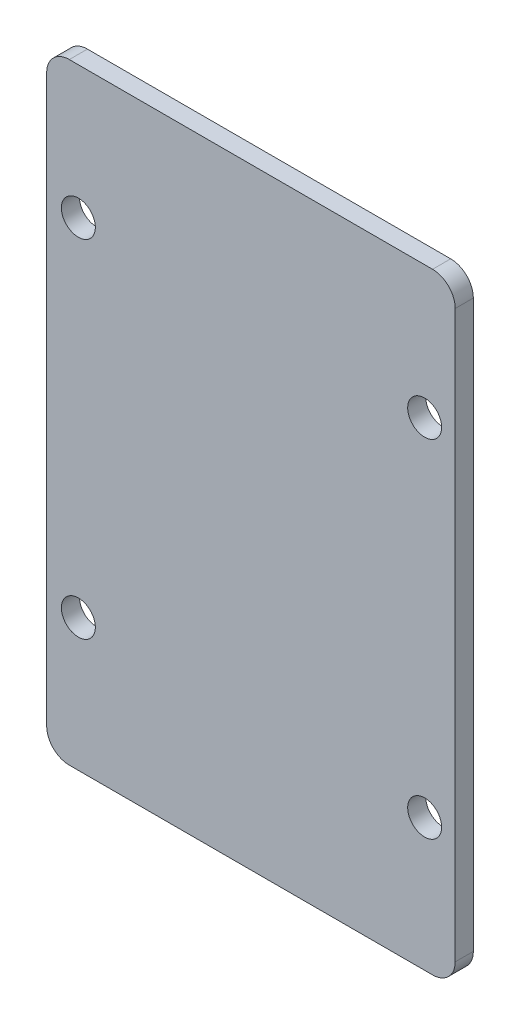
from build123d import *

# Parameters (mm, degrees)
BOARD2_R        = 1.5
EXTRUDE_2_DEPTH = 1.6


with BuildPart() as part:
    # Board2 → Бобышка-Вытянуть2 (new body)
    with BuildSketch(Plane.XY):
        with BuildLine():
            Line((115.649904348, 52), (115.649904348, 2))
            ThreePointArc((115.649904348, 2), (116.235690785, 0.585786438), (117.649904348, 0))
            Line((117.649904348, 0), (149.749904348, 0))
            ThreePointArc((149.749904348, 0), (151.16411791, 0.585786438), (151.749904348, 2))
            Line((151.749904348, 2), (151.749904348, 52))
            ThreePointArc((151.749904348, 52), (151.16411791, 53.414213562), (149.749904348, 54))
            Line((149.749904348, 54), (117.649904348, 54))
            ThreePointArc((117.649904348, 54), (116.235690785, 53.414213562), (115.649904348, 52))
        make_face()
        with Locations((149.049904348, 42.3)):
            Circle(BOARD2_R, mode=Mode.SUBTRACT)
        with Locations((149.049904348, 11.7)):
            Circle(BOARD2_R, mode=Mode.SUBTRACT)
        with Locations((118.449904348, 11.7)):
            Circle(BOARD2_R, mode=Mode.SUBTRACT)
        with Locations((118.449904348, 42.3)):
            Circle(BOARD2_R, mode=Mode.SUBTRACT)
    extrude(amount=EXTRUDE_2_DEPTH)


solid = part.part
